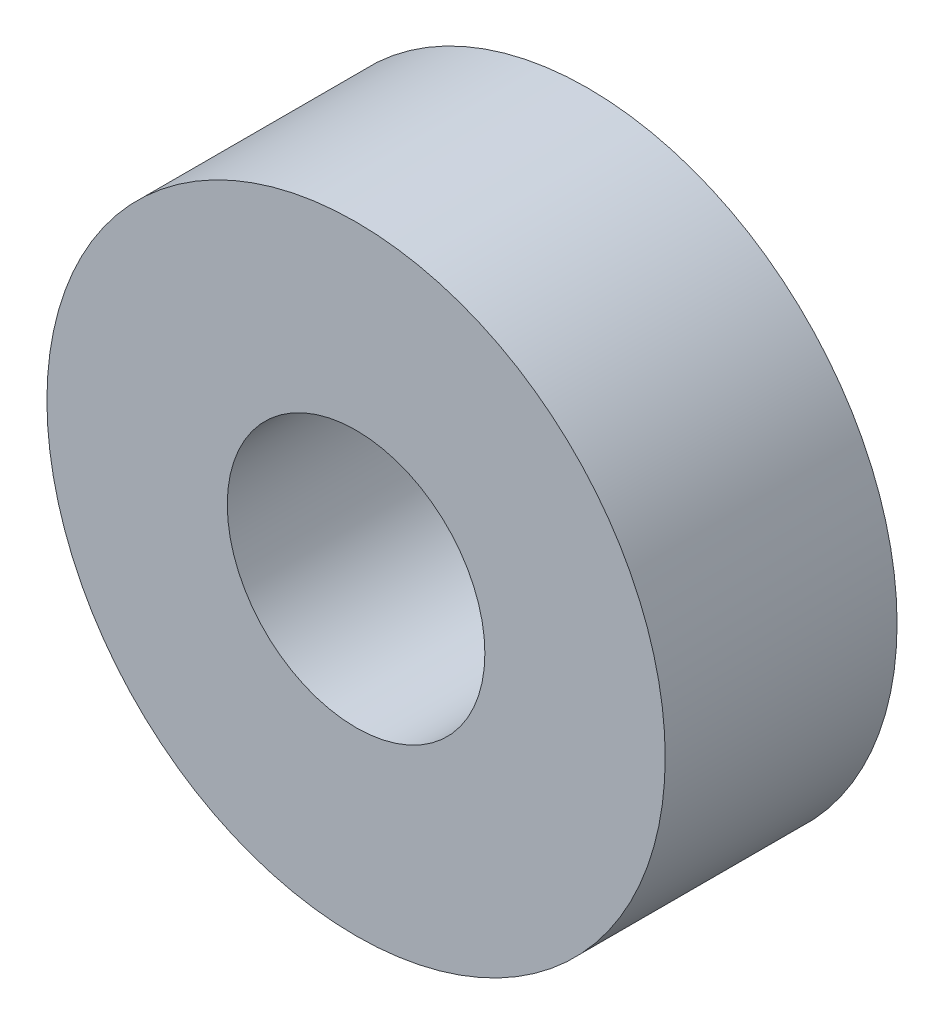
from build123d import *

# Parameters (mm, degrees)
SKETCH_1_R      = 12
SKETCH_1_R_2    = 5
EXTRUDE_1_DEPTH = 9


with BuildPart() as part:
    # 草图1 → 凸台-拉伸1 (new body)
    with BuildSketch(Plane.XY):
        Circle(SKETCH_1_R)
        Circle(SKETCH_1_R_2, mode=Mode.SUBTRACT)
    extrude(amount=EXTRUDE_1_DEPTH)


solid = part.part
